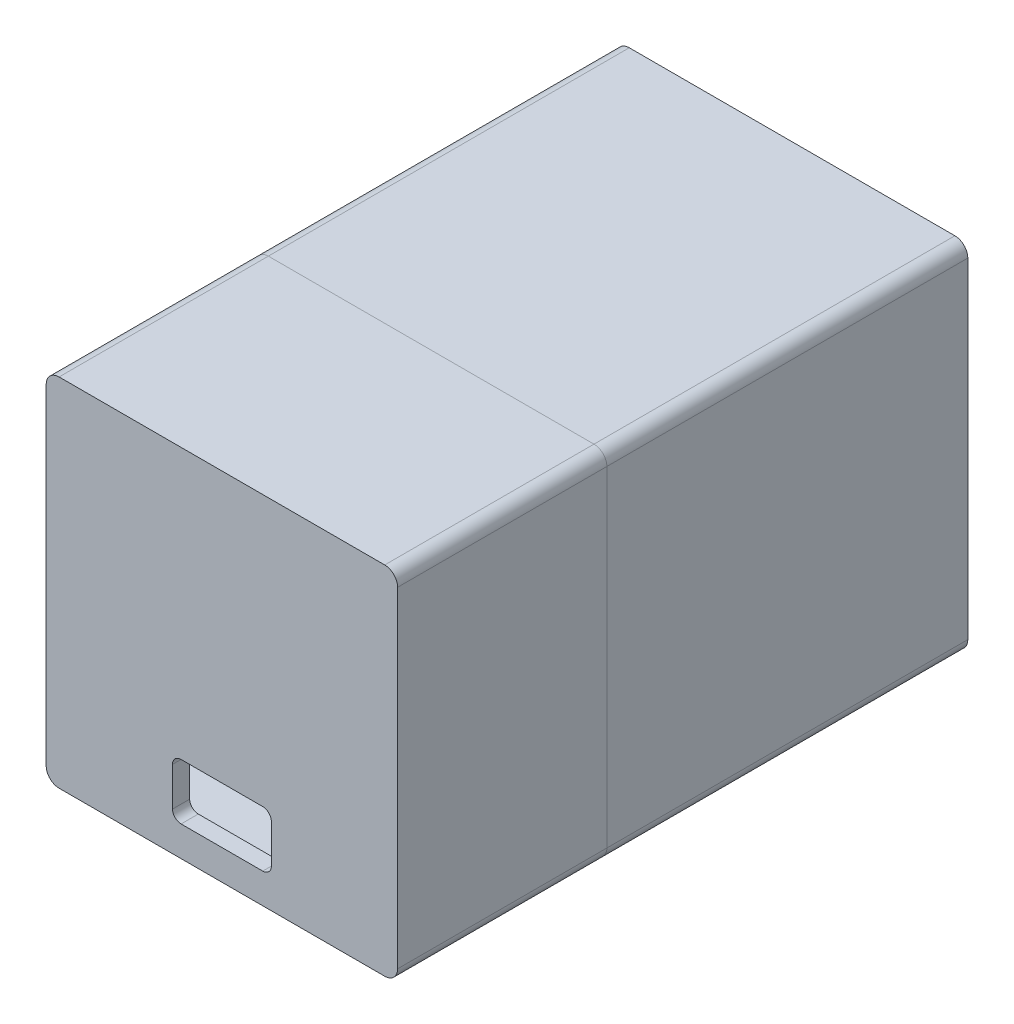
from build123d import *

# Parameters (mm, degrees)
SKETCH1_W           = 73.787
SKETCH1_H           = 72.898
BOSS_EXTRUDE1_DEPTH = 123.698
SHELL1_T            = 4
SKETCH2_W           = 81.787
SKETCH2_H           = 80.898
SKETCH2_W_2         = 73.787
SKETCH2_H_2         = 72.898
BOSS_EXTRUDE2_DEPTH = 1
SKETCH7_W           = 81.787
SKETCH7_H           = 80.898
BOSS_EXTRUDE5_DEPTH = 4
SKETCH3_W           = 81.787
SKETCH3_H           = 132.698
BOSS_EXTRUDE3_DEPTH = 2
SKETCH4_R           = 3.025
CUT_EXTRUDE2_DEPTH  = 5
FILLET1_R           = 3
SKETCH5_W           = 77.787
SKETCH5_H           = 76.898
SKETCH5_W_2         = 73.787
SKETCH5_H_2         = 72.898
BOSS_EXTRUDE4_DEPTH = 20
SKETCH6_W           = 78.087
SKETCH6_H           = 77.198
CUT_EXTRUDE3_DEPTH  = 21
SKETCH8_W           = 23
SKETCH8_H           = 13
CUT_EXTRUDE4_DEPTH  = 10
FILLET2_R           = 2


with BuildPart() as part:
    # Sketch1 → Boss-Extrude1 (new body)
    with BuildSketch(Plane.XY):
        Rectangle(SKETCH1_W, SKETCH1_H)
    extrude(amount=BOSS_EXTRUDE1_DEPTH)

    # Shell1
    shell1_openings = [part.faces().sort_by_distance(p)[0] for p in [
        (0, 0, 123.698),
    ]]
    offset(amount=SHELL1_T, openings=shell1_openings, kind=Kind.INTERSECTION)

    # Sketch2 → Boss-Extrude2 (add)
    with BuildSketch(Plane.XY.offset(123.698)):
        Rectangle(SKETCH2_W, SKETCH2_H)
        Rectangle(SKETCH2_W_2, SKETCH2_H_2, mode=Mode.SUBTRACT)
    extrude(amount=BOSS_EXTRUDE2_DEPTH)

    # Sketch7 → Boss-Extrude5 (add)
    with BuildSketch(Plane.XY.offset(124.698)):
        Rectangle(SKETCH7_W, SKETCH7_H)
    extrude(amount=BOSS_EXTRUDE5_DEPTH)

    # Sketch3 → Boss-Extrude3 (add)
    with BuildSketch(Plane.XZ.offset(40.449)):
        with Locations((0, 62.349)):
            Rectangle(SKETCH3_W, SKETCH3_H)
    extrude(amount=BOSS_EXTRUDE3_DEPTH)

    # Sketch4 → Cut-Extrude2 (cut)
    with BuildSketch(Plane.XZ.offset(42.449)):
        with Locations((-22.225, 109.648)):
            Circle(SKETCH4_R)
        with Locations((22.225, 109.648)):
            Circle(SKETCH4_R)
        with Locations((-22.225, 15.05)):
            Circle(SKETCH4_R)
        with Locations((22.225, 15.05)):
            Circle(SKETCH4_R)
    extrude(amount=-CUT_EXTRUDE2_DEPTH, mode=Mode.SUBTRACT)

    # Fillet1
    fillet1_edges = [part.edges().sort_by_distance(p)[0] for p in [
        (-40.8935, -42.449, 62.349),
        (40.8935, -42.449, 62.349),
        (40.8935, 40.449, 62.349),
        (-40.8935, 40.449, 62.349),
    ]]
    fillet(fillet1_edges, radius=FILLET1_R)


with BuildPart() as body_2:
    # Split1: the piece on the far side of the plane
    add(part.part)
    split(bisect_by=Plane.XY.offset(80), keep=Keep.BOTTOM)

    # Sketch5 → Boss-Extrude4 (add)
    with BuildSketch(Plane.XY.offset(80)):
        Rectangle(SKETCH5_W, SKETCH5_H)
        Rectangle(SKETCH5_W_2, SKETCH5_H_2, mode=Mode.SUBTRACT)
    extrude(amount=BOSS_EXTRUDE4_DEPTH)


with BuildPart() as part_1:
    add(part.part)

    # Split1
    split(bisect_by=Plane.XY.offset(80), keep=Keep.TOP)

    # Sketch6 → Cut-Extrude3 (cut)
    with BuildSketch(Plane(origin=(0, 0, 80), x_dir=(-1, 0, 0), z_dir=(0, 0, -1))):
        Rectangle(SKETCH6_W, SKETCH6_H)
    extrude(amount=-CUT_EXTRUDE3_DEPTH, mode=Mode.SUBTRACT)

    # Sketch8 → Cut-Extrude4 (cut)
    with BuildSketch(Plane.XY.offset(128.698)):
        with Locations((0, -28.949)):
            Rectangle(SKETCH8_W, SKETCH8_H)
    extrude(amount=-CUT_EXTRUDE4_DEPTH, mode=Mode.SUBTRACT)

    # Fillet2
    fillet2_edges = [part_1.edges().sort_by_distance(p)[0] for p in [
        (11.5, -22.449, 126.698),
        (11.5, -35.449, 126.698),
        (-11.5, -35.449, 126.698),
        (-11.5, -22.449, 126.698),
    ]]
    fillet(fillet2_edges, radius=FILLET2_R)


solid = Compound([body_2.part, part_1.part])
